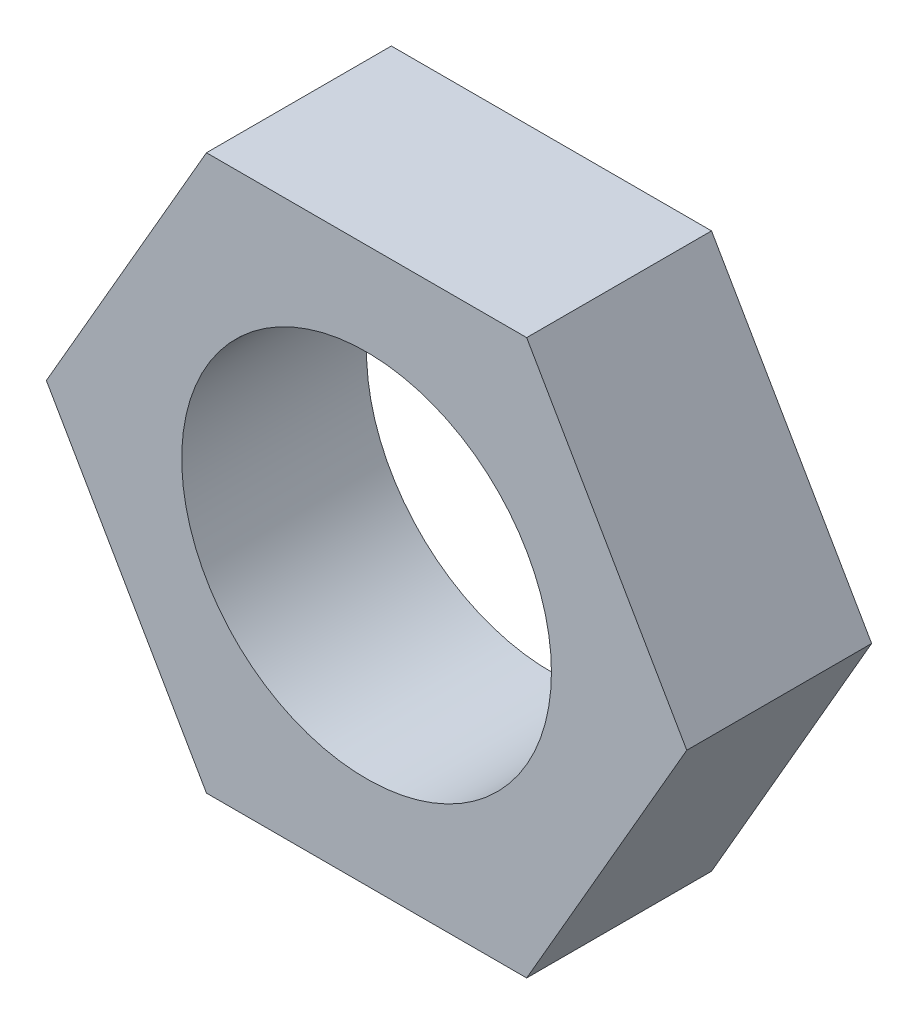
from build123d import *

# Parameters (mm, degrees)
SKETCH_1_R      = 2
EXTRUDE_1_DEPTH = 2


with BuildPart() as part:
    # 스케치1 → 보스-돌출1 (new body)
    with BuildSketch(Plane.XY):
        Polygon((3.464101615, 0), (1.732050808, 3), (-1.732050808, 3), (-3.464101615, 0), (-1.732050808, -3), (1.732050808, -3), align=None)
        Circle(SKETCH_1_R, mode=Mode.SUBTRACT)
    extrude(amount=EXTRUDE_1_DEPTH)


solid = part.part
